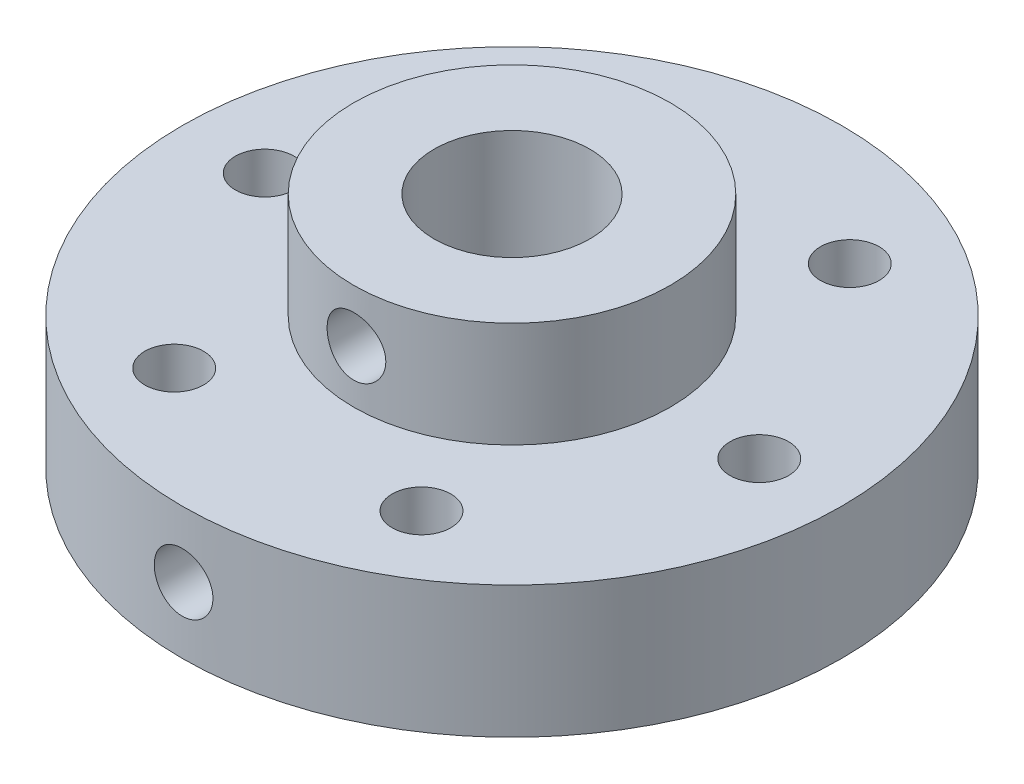
from build123d import *

# Parameters (mm, degrees)
SKETCH1_R                      = 12.7
BOSS_EXTRUDE1_DEPTH            = 5.08
SKETCH2_R                      = 6.096
BOSS_EXTRUDE2_DEPTH            = 4.064
SKETCH3_R                      = 3
CUT_EXTRUDE1_DEPTH             = 21.154223776
SKETCH7_W                      = 1.1303
SKETCH7_H                      = 12.7
F_4_40_TAPPED_HOLE1_AT_2_COUNT = 2
F_4_40_TAPPED_HOLE1_AT_2_PITCH = 4.572
F_4_40_TAPPED_HOLE2_D          = 2.2606


with BuildPart() as part:
    # Sketch1 → Boss-Extrude1 (new body)
    with BuildSketch(Plane(origin=(0, 0, 0), x_dir=(1, 0, 0), z_dir=(0, 1, 0))):
        with Locations(Location((0, 0, 0), (0, 0, 270))):
            Circle(SKETCH1_R)
    extrude(amount=BOSS_EXTRUDE1_DEPTH)

    # Sketch2 → Boss-Extrude2 (add)
    with BuildSketch(Plane(origin=(0, 5.08, 0), x_dir=(1, 0, 0), z_dir=(0, 1, 0))):
        with Locations(Location((0, 0, 0), (0, 0, 270))):
            Circle(SKETCH2_R)
    extrude(amount=BOSS_EXTRUDE2_DEPTH)

    # Sketch3 → Cut-Extrude1 (cut, through all)
    with BuildSketch(Plane(origin=(0, 9.144, 0), x_dir=(1, 0, 0), z_dir=(0, 1, 0))):
        with Locations(Location((0, 0, 0), (0, 0, 270))):
            Circle(SKETCH3_R)
    extrude(amount=-CUT_EXTRUDE1_DEPTH, mode=Mode.SUBTRACT)

    # Sketch7 → #4-40 Tapped Hole1 (revolve, cut)
    with BuildSketch(Plane(origin=(0, 7.112, 0), x_dir=(0, 1, 0), z_dir=(1, 0, 0))):
        with Locations((0.56515, 6.35)):
            Rectangle(SKETCH7_W, SKETCH7_H)
    f_4_40_tapped_hole1 = revolve(axis=Axis((0, 7.112, -6.35), (0, 0, 1)), mode=Mode.SUBTRACT)

    # #4-40 Tapped Hole1 at 2: #4-40 Tapped Hole1 ×2
    with Locations(*[(0, -i * F_4_40_TAPPED_HOLE1_AT_2_PITCH, 0) for i in range(1, F_4_40_TAPPED_HOLE1_AT_2_COUNT)]):
        add(f_4_40_tapped_hole1, mode=Mode.SUBTRACT)

    # #4-40 Tapped Hole2 (through all)
    with Locations(Plane(origin=(0, 0, 0), x_dir=(-1, 0, 0), z_dir=(0, -1, 0))):
        with Locations((9.525, 0), (4.7625, -8.248891971), (-4.7625, -8.248891971), (-9.525, 0), (-4.7625, 8.248891971), (4.7625, 8.248891971)):
            Hole(F_4_40_TAPPED_HOLE2_D / 2)


solid = part.part
